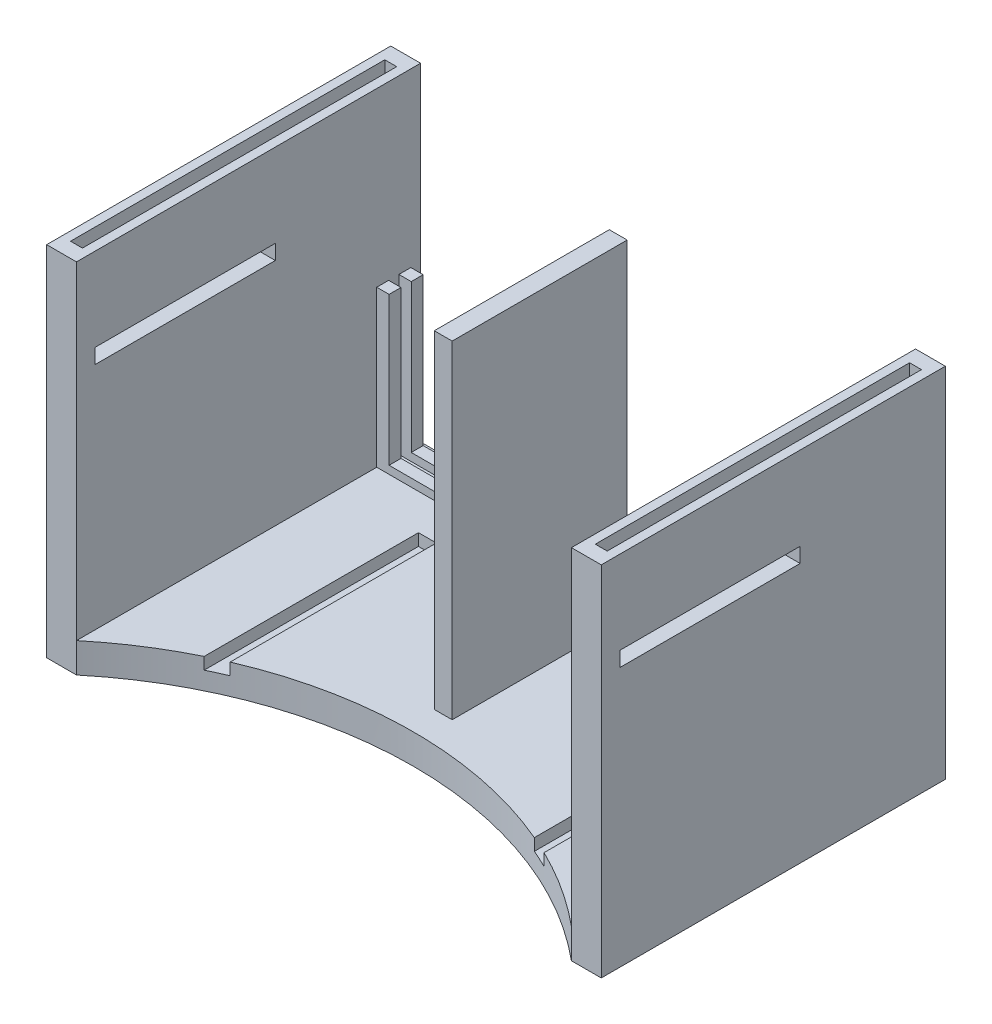
from build123d import *

# Parameters (mm, degrees)
EXTRUDE_THIN2_DEPTH     = 115.4
SKETCH11_W              = 166
SKETCH11_H              = 4
BOSS_EXTRUDE3_DEPTH     = 2.6416
CUT_EXTRUDE6_DEPTH      = 243.26671253
CUT_EXTRUDE6_DEPTH_BACK = 243.26671253
SKETCH13_W              = 60.495011338
SKETCH13_H              = 5
CUT_EXTRUDE7_DEPTH      = 245.975835543
SKETCH19_W              = 4
SKETCH19_H              = 105.4
CUT_EXTRUDE9_DEPTH      = 10
SKETCH20_W              = 4
SKETCH20_H              = 105.4
CUT_EXTRUDE10_DEPTH     = 10
SKETCH21_W              = 6
SKETCH21_H              = 58.697
BOSS_EXTRUDE4_DEPTH     = 110
CUT_EXTRUDE11_DEPTH     = 4
SKETCH23_W              = 166
SKETCH23_H              = 4
BOSS_EXTRUDE5_DEPTH     = 2.6416
SKETCH24_W              = 4.14
SKETCH24_H              = 4
BOSS_EXTRUDE6_DEPTH     = 49.64
SKETCH25_W              = 4.14
SKETCH25_H              = 4
BOSS_EXTRUDE7_DEPTH     = 49.64
SKETCH26_W              = 4.14
SKETCH26_H              = 4
BOSS_EXTRUDE8_DEPTH     = 49.64
SKETCH27_W              = 4.14
SKETCH27_H              = 4
BOSS_EXTRUDE9_DEPTH     = 49.64


with BuildPart() as part:
    # Sketch2 → Extrude-Thin2 (new body)
    with BuildSketch(Plane.XY):
        Polygon((0, 120), (0, 0), (186, 0), (186, 120), (176, 120), (176, 10), (10, 10), (10, 120), align=None)
    extrude(amount=EXTRUDE_THIN2_DEPTH)

    # Sketch11 → Boss-Extrude3 (add)
    with BuildSketch(Plane(origin=(0, 10, 0), x_dir=(1, 0, 0), z_dir=(0, 1, 0))):
        with Locations((93, -12.703)):
            Rectangle(SKETCH11_W, SKETCH11_H)
    extrude(amount=BOSS_EXTRUDE3_DEPTH)

    # Sketch13 → Cut-Extrude6 (cut, two sides: drawn at the far end of the back side and taken through both)
    with BuildSketch(Plane(origin=(10, 0, 0), x_dir=(0, 0, -1), z_dir=(1, 0, 0)).offset(-CUT_EXTRUDE6_DEPTH_BACK)):
        with Locations((-78.947505669, 89.551599899)):
            Rectangle(SKETCH13_W, SKETCH13_H)
    extrude(amount=CUT_EXTRUDE6_DEPTH + CUT_EXTRUDE6_DEPTH_BACK, mode=Mode.SUBTRACT)

    # Sketch14 → Cut-Extrude7 (cut, through all)
    with BuildSketch(Plane(origin=(0, 10, 0), x_dir=(1, 0, 0), z_dir=(0, 1, 0))):
        with BuildLine():
            Line((176, -115.4), (10, -115.4))
            ThreePointArc((10, -115.4), (93, -85.4), (176, -115.4))
        make_face()
    extrude(amount=-CUT_EXTRUDE7_DEPTH, mode=Mode.SUBTRACT)

    # Sketch19 → Cut-Extrude9 (cut)
    with BuildSketch(Plane(origin=(0, 120, 0), x_dir=(1, 0, 0), z_dir=(0, 1, 0))):
        with Locations((5, -57.7)):
            Rectangle(SKETCH19_W, SKETCH19_H)
    extrude(amount=-CUT_EXTRUDE9_DEPTH, mode=Mode.SUBTRACT)

    # Sketch20 → Cut-Extrude10 (cut)
    with BuildSketch(Plane(origin=(0, 120, 0), x_dir=(1, 0, 0), z_dir=(0, 1, 0))):
        with Locations((181, -57.7)):
            Rectangle(SKETCH20_W, SKETCH20_H)
    extrude(amount=-CUT_EXTRUDE10_DEPTH, mode=Mode.SUBTRACT)

    # Sketch21 → Boss-Extrude4 (add, through all)
    with BuildSketch(Plane(origin=(0, 10, 0), x_dir=(1, 0, 0), z_dir=(0, 1, 0))):
        with Locations((93, -46.0515)):
            Rectangle(SKETCH21_W, SKETCH21_H)
    extrude(amount=BOSS_EXTRUDE4_DEPTH)

    # Sketch22 → Cut-Extrude11 (cut)
    with BuildSketch(Plane(origin=(0, 10, 0), x_dir=(1, 0, 0), z_dir=(0, 1, 0))):
        Polygon((36, -26.703), (36, -98.583194008), (42, -95.837577441), (42, -26.703), align=None)
        Polygon((144, -95.837577441), (150, -98.583194008), (150, -26.703), (144, -26.703), align=None)
    extrude(amount=-CUT_EXTRUDE11_DEPTH, mode=Mode.SUBTRACT)

    # Sketch23 → Boss-Extrude5 (add)
    with BuildSketch(Plane(origin=(0, 10, 0), x_dir=(1, 0, 0), z_dir=(0, 1, 0))):
        with Locations((93, -5.263)):
            Rectangle(SKETCH23_W, SKETCH23_H)
    extrude(amount=BOSS_EXTRUDE5_DEPTH)

    # Sketch24 → Boss-Extrude6 (add)
    with BuildSketch(Plane(origin=(0, 12.6416, 0), x_dir=(1, 0, 0), z_dir=(0, 1, 0))):
        with Locations((12.07, -5.263)):
            Rectangle(SKETCH24_W, SKETCH24_H)
    extrude(amount=BOSS_EXTRUDE6_DEPTH)

    # Sketch25 → Boss-Extrude7 (add)
    with BuildSketch(Plane(origin=(0, 12.6416, 0), x_dir=(1, 0, 0), z_dir=(0, 1, 0))):
        with Locations((173.93, -5.263)):
            Rectangle(SKETCH25_W, SKETCH25_H)
    extrude(amount=BOSS_EXTRUDE7_DEPTH)

    # Sketch26 → Boss-Extrude8 (add)
    with BuildSketch(Plane(origin=(0, 12.6416, 0), x_dir=(1, 0, 0), z_dir=(0, 1, 0))):
        with Locations((12.07, -12.703)):
            Rectangle(SKETCH26_W, SKETCH26_H)
    extrude(amount=BOSS_EXTRUDE8_DEPTH)

    # Sketch27 → Boss-Extrude9 (add)
    with BuildSketch(Plane(origin=(0, 12.6416, 0), x_dir=(1, 0, 0), z_dir=(0, 1, 0))):
        with Locations((173.93, -12.703)):
            Rectangle(SKETCH27_W, SKETCH27_H)
    extrude(amount=BOSS_EXTRUDE9_DEPTH)


solid = part.part
